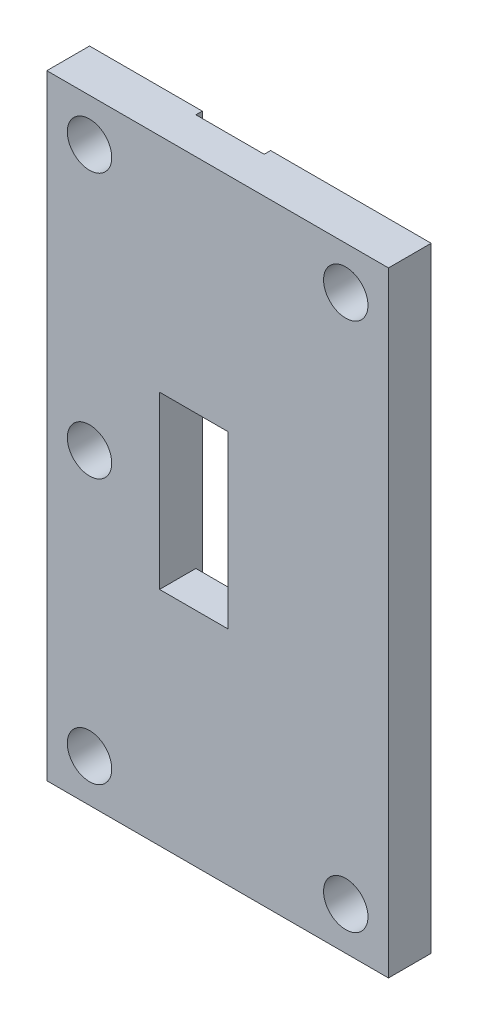
from build123d import *

# Parameters (mm, degrees)
SKETCH1_W           = 40
SKETCH1_H           = 5
BOSS_EXTRUDE1_DEPTH = 72
SKETCH2_W           = 8
SKETCH2_H           = 72
CUT_EXTRUDE1_DEPTH  = 0.75
SKETCH3_W           = 0.6
SKETCH3_H           = 0.6
BOSS_EXTRUDE2_DEPTH = 8
SKETCH4_R           = 2.6
CUT_EXTRUDE2_DEPTH  = 83.516664984
SKETCH5_W           = 8
SKETCH5_H           = 20
CUT_EXTRUDE3_DEPTH  = 83.516664984


with BuildPart() as part:
    # Sketch1 → Boss-Extrude1 (new body)
    with BuildSketch(Plane(origin=(0, 0, 0), x_dir=(1, 0, 0), z_dir=(0, 1, 0))):
        with Locations((20, 2.5)):
            Rectangle(SKETCH1_W, SKETCH1_H)
    extrude(amount=BOSS_EXTRUDE1_DEPTH)

    # Sketch2 → Cut-Extrude1 (cut)
    with BuildSketch(Plane(origin=(0, 0, -5), x_dir=(-1, 0, 0), z_dir=(0, 0, -1))):
        with Locations((-17.2, 36)):
            Rectangle(SKETCH2_W, SKETCH2_H)
    extrude(amount=-CUT_EXTRUDE1_DEPTH, mode=Mode.SUBTRACT)

    # Sketch3 → Boss-Extrude2 (add)
    with BuildSketch(Plane(origin=(13.2, 0, 0), x_dir=(0, 0, -1), z_dir=(1, 0, 0))):
        with Locations((4.55, 71.1)):
            Rectangle(SKETCH3_W, SKETCH3_H)
        with Locations((4.55, 69.1)):
            Rectangle(SKETCH3_W, SKETCH3_H)
        with Locations((4.55, 67.1)):
            Rectangle(SKETCH3_W, SKETCH3_H)
        with Locations((4.55, 65.1)):
            Rectangle(SKETCH3_W, SKETCH3_H)
        with Locations((4.55, 63.1)):
            Rectangle(SKETCH3_W, SKETCH3_H)
        with Locations((4.55, 61.1)):
            Rectangle(SKETCH3_W, SKETCH3_H)
        with Locations((4.55, 59.1)):
            Rectangle(SKETCH3_W, SKETCH3_H)
        with Locations((4.55, 57.1)):
            Rectangle(SKETCH3_W, SKETCH3_H)
        with Locations((4.55, 55.1)):
            Rectangle(SKETCH3_W, SKETCH3_H)
        with Locations((4.55, 53.1)):
            Rectangle(SKETCH3_W, SKETCH3_H)
        with Locations((4.55, 51.1)):
            Rectangle(SKETCH3_W, SKETCH3_H)
        with Locations((4.55, 49.1)):
            Rectangle(SKETCH3_W, SKETCH3_H)
        with Locations((4.55, 47.1)):
            Rectangle(SKETCH3_W, SKETCH3_H)
        with Locations((4.55, 45.1)):
            Rectangle(SKETCH3_W, SKETCH3_H)
        with Locations((4.55, 43.1)):
            Rectangle(SKETCH3_W, SKETCH3_H)
        with Locations((4.55, 41.1)):
            Rectangle(SKETCH3_W, SKETCH3_H)
        with Locations((4.55, 39.1)):
            Rectangle(SKETCH3_W, SKETCH3_H)
        with Locations((4.55, 37.1)):
            Rectangle(SKETCH3_W, SKETCH3_H)
        with Locations((4.55, 35.1)):
            Rectangle(SKETCH3_W, SKETCH3_H)
        with Locations((4.55, 33.1)):
            Rectangle(SKETCH3_W, SKETCH3_H)
        with Locations((4.55, 31.1)):
            Rectangle(SKETCH3_W, SKETCH3_H)
        with Locations((4.55, 29.1)):
            Rectangle(SKETCH3_W, SKETCH3_H)
        with Locations((4.55, 27.1)):
            Rectangle(SKETCH3_W, SKETCH3_H)
        with Locations((4.55, 25.1)):
            Rectangle(SKETCH3_W, SKETCH3_H)
        with Locations((4.55, 23.1)):
            Rectangle(SKETCH3_W, SKETCH3_H)
        with Locations((4.55, 21.1)):
            Rectangle(SKETCH3_W, SKETCH3_H)
        with Locations((4.55, 19.1)):
            Rectangle(SKETCH3_W, SKETCH3_H)
        with Locations((4.55, 17.1)):
            Rectangle(SKETCH3_W, SKETCH3_H)
        with Locations((4.55, 15.1)):
            Rectangle(SKETCH3_W, SKETCH3_H)
        with Locations((4.55, 13.1)):
            Rectangle(SKETCH3_W, SKETCH3_H)
        with Locations((4.55, 11.1)):
            Rectangle(SKETCH3_W, SKETCH3_H)
        with Locations((4.55, 9.1)):
            Rectangle(SKETCH3_W, SKETCH3_H)
        with Locations((4.55, 7.1)):
            Rectangle(SKETCH3_W, SKETCH3_H)
        with Locations((4.55, 5.1)):
            Rectangle(SKETCH3_W, SKETCH3_H)
        with Locations((4.55, 3.1)):
            Rectangle(SKETCH3_W, SKETCH3_H)
        with Locations((4.55, 1.1)):
            Rectangle(SKETCH3_W, SKETCH3_H)
    extrude(amount=BOSS_EXTRUDE2_DEPTH)

    # Sketch4 → Cut-Extrude2 (cut, through all)
    with BuildSketch(Plane.XY):
        with Locations((5, 67)):
            Circle(SKETCH4_R)
        with Locations((35, 67)):
            Circle(SKETCH4_R)
        with Locations((5, 5)):
            Circle(SKETCH4_R)
        with Locations((35, 5)):
            Circle(SKETCH4_R)
        with Locations((5, 36)):
            Circle(SKETCH4_R)
    extrude(amount=-CUT_EXTRUDE2_DEPTH, mode=Mode.SUBTRACT)

    # Sketch5 → Cut-Extrude3 (cut, through all)
    with BuildSketch(Plane.XY):
        with Locations((17.2, 36)):
            Rectangle(SKETCH5_W, SKETCH5_H)
    extrude(amount=-CUT_EXTRUDE3_DEPTH, mode=Mode.SUBTRACT)


solid = part.part
